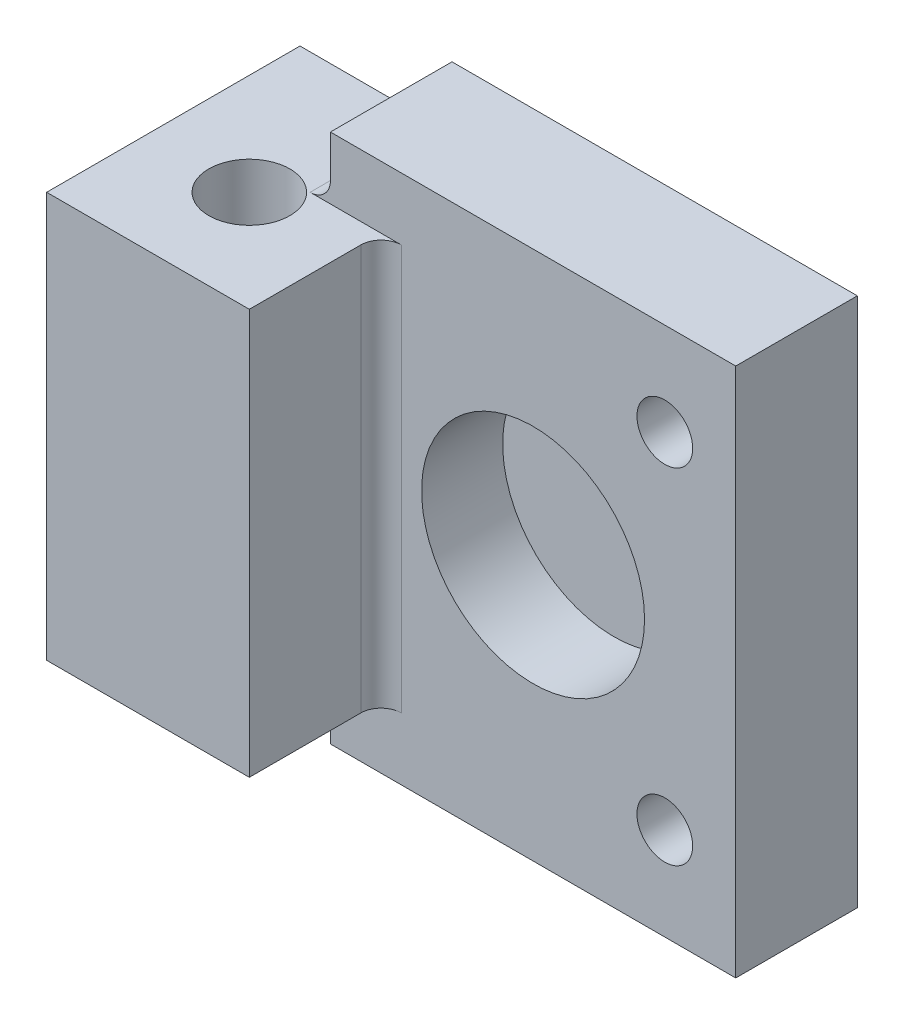
from build123d import *

# Parameters (mm, degrees)
SKETCH1_W           = 40
SKETCH1_H           = 52.3
SKETCH1_R           = 2.75
BOSS_EXTRUDE1_DEPTH = 12
SKETCH2_R           = 11
CUT_EXTRUDE1_DEPTH  = 8
SKETCH6_W           = 25
SKETCH6_H           = 40
BOSS_EXTRUDE3_DEPTH = 20
SKETCH7_R           = 4
CUT_EXTRUDE3_DEPTH  = 35
FILLET1_R           = 2
FILLET2_R           = 2


with BuildPart() as part:
    # Sketch1 → Boss-Extrude1 (new body)
    with BuildSketch(Plane.XY):
        Rectangle(SKETCH1_W, SKETCH1_H)
        with Locations((13, 16.9975)):
            Circle(SKETCH1_R, mode=Mode.SUBTRACT)
        with Locations((13, -16.9975)):
            Circle(SKETCH1_R, mode=Mode.SUBTRACT)
    extrude(amount=BOSS_EXTRUDE1_DEPTH)

    # Sketch2 → Cut-Extrude1 (cut)
    with BuildSketch(Plane.XY.offset(12)):
        Circle(SKETCH2_R)
    extrude(amount=-CUT_EXTRUDE1_DEPTH, mode=Mode.SUBTRACT)

    # Sketch6 → Boss-Extrude3 (add)
    with BuildSketch(Plane.ZY.offset(15)):
        with Locations((12.5, 0)):
            Rectangle(SKETCH6_W, SKETCH6_H)
    extrude(amount=BOSS_EXTRUDE3_DEPTH)

    # Sketch7 → Cut-Extrude3 (cut)
    with BuildSketch(Plane(origin=(0, 20, 0), x_dir=(1, 0, 0), z_dir=(0, 1, 0))):
        with Locations(Location((-25, -15, 0), (0, 0, 180))):
            Circle(SKETCH7_R)
    extrude(amount=-CUT_EXTRUDE3_DEPTH, mode=Mode.SUBTRACT)

    # Fillet1
    fillet1_edges = [part.edges().sort_by_distance(p)[0] for p in [
        (-20, 20, 6),
        (-20, -20, 6),
    ]]
    fillet(fillet1_edges, radius=FILLET1_R)

    # Fillet2
    fillet2_edges = [part.edges().sort_by_distance(p)[0] for p in [
        (-15, 0, 12),
    ]]
    fillet(fillet2_edges, radius=FILLET2_R)


solid = part.part
